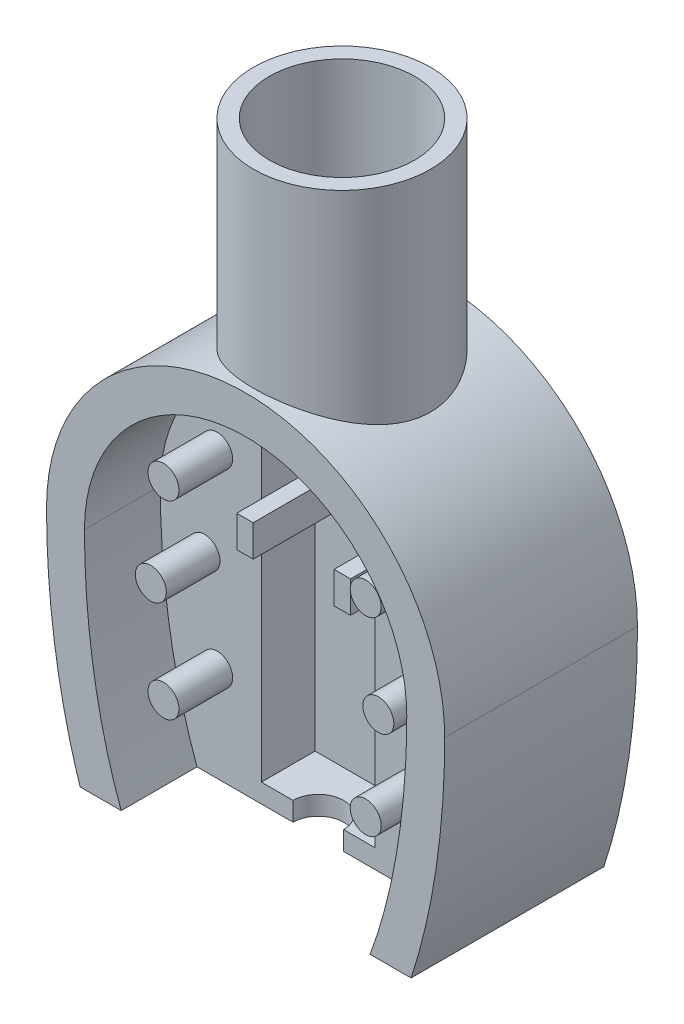
from build123d import *

# Parameters (mm, degrees)
SALIENTE_EXTRUIR2_DEPTH      = 30.5
CROQUIS14_R                  = 25.5
CORTAR_EXTRUIR1_DEPTH        = 12
SALIENTE_EXTRUIR3_DEPTH      = 30
SALIENTE_EXTRUIR3_DEPTH_BACK = 4
CROQUIS15_R                  = 14
CROQUIS16_R                  = 11.5
CORTAR_EXTRUIR2_DEPTH        = 25
SKETCH1_W                    = 18
SKETCH1_H                    = 53
CUT_EXTRUDE1_DEPTH           = 8.5
SKETCH2_R                    = 4
CUT_EXTRUDE2_DEPTH           = 3
SKETCH3_R                    = 2.45
BOSS_EXTRUDE1_DEPTH          = 8.5
SKETCH4_W                    = 2.6
SKETCH4_H                    = 5
BOSS_EXTRUDE2_DEPTH          = 12.4


with BuildPart() as part:
    # Croquis13 → Saliente-Extruir2 (new body)
    with BuildSketch(Plane.XY):
        with BuildLine():
            Line((63.278452832, -47.557716663), (115.634697867, -47.557716663))
            add(Edge.make_bspline(
                [(115.634697867, -47.557716663), (120.956575349, -31.401681318), (120.956575349, -11.961207195)],
                knots=[0.980995561, 0.980995561, 0.980995561, 1.570796327, 1.570796327, 1.570796327], degree=2, weights=[1, 0.9568311, 1]))
            ThreePointArc((120.956575349, -11.961207195), (89.456575349, 19.538792805), (57.956575349, -11.961207195))
            add(Edge.make_bspline(
                [(57.956575349, -11.961207195), (57.956575349, -31.401681318), (63.278452832, -47.557716663)],
                knots=[4.71238898, 4.71238898, 4.71238898, 5.302189747, 5.302189747, 5.302189747], degree=2, weights=[1, 0.9568311, 1]))
        make_face()
    extrude(amount=SALIENTE_EXTRUIR2_DEPTH)

    # Croquis14 → Cortar-Extruir1 (cut)
    with BuildSketch(Plane.XY.offset(30.5)):
        with Locations((89.456575349, -11.961207195)):
            Circle(CROQUIS14_R)
        with BuildLine():
            add(Edge.make_bspline(
                [(109.141957532, -47.557716663), (114.956575349, -32.049805489), (114.956575349, -11.961207195)],
                knots=[4.023536226, 4.023536226, 4.023536226, 4.71238898, 4.71238898, 4.71238898], degree=2, weights=[1, 0.941269295, 1]))
            ThreePointArc((114.956575349, -11.961207195), (89.456575349, -37.461207195), (63.956575349, -11.961207195))
            add(Edge.make_bspline(
                [(63.956575349, -11.961207195), (63.956575349, -32.049805489), (69.771193166, -47.557716663)],
                knots=[1.570796327, 1.570796327, 1.570796327, 2.259649081, 2.259649081, 2.259649081], degree=2, weights=[1, 0.941269295, 1]))
            Line((69.771193166, -47.557716663), (109.141957532, -47.557716663))
        make_face()
    extrude(amount=-CORTAR_EXTRUIR1_DEPTH, mode=Mode.SUBTRACT)

    # Croquis15 → Saliente-Extruir3 (add, two sides: drawn at the far end of the back side and taken through both)
    with BuildSketch(Plane(origin=(89.456575349, 19.538792805, 30.5), x_dir=(1, 0, 0), z_dir=(0, 1, 0)).offset(-SALIENTE_EXTRUIR3_DEPTH_BACK)):
        with Locations(Location((0, 15.25, 0), (0, 0, 270))):
            Circle(CROQUIS15_R)
    extrude(amount=SALIENTE_EXTRUIR3_DEPTH + SALIENTE_EXTRUIR3_DEPTH_BACK)

    # Croquis16 → Cortar-Extruir2 (cut)
    with BuildSketch(Plane(origin=(0, 49.538792805, 0), x_dir=(1, 0, 0), z_dir=(0, 1, 0))):
        with Locations(Location((89.456575349, -15.25, 0), (0, 0, 270))):
            Circle(CROQUIS16_R)
    extrude(amount=-CORTAR_EXTRUIR2_DEPTH, mode=Mode.SUBTRACT)

    # Sketch1 → Cut-Extrude1 (cut)
    with BuildSketch(Plane(origin=(0, -29.057716663, 18.5), x_dir=(-1, 0, 0), z_dir=(0, 0, -1))):
        with Locations((-88.956575349, 11)):
            Rectangle(SKETCH1_W, SKETCH1_H)
    extrude(amount=CUT_EXTRUDE1_DEPTH, mode=Mode.SUBTRACT)

    # Sketch2 → Cut-Extrude2 (cut)
    with BuildSketch(Plane.XZ.offset(44.557716663)):
        with Locations((88.956575349, 18.5)):
            Circle(SKETCH2_R)
    extrude(amount=CUT_EXTRUDE2_DEPTH, mode=Mode.SUBTRACT)

    # Sketch3 → Boss-Extrude1 (add)
    with BuildSketch(Plane.XY.offset(18.5)):
        with Locations((104.956575349, -32.557716663)):
            Circle(SKETCH3_R)
        with Locations((104.956575349, -2.557716663)):
            Circle(SKETCH3_R)
        with Locations((70.956575349, -17.557716663)):
            Circle(SKETCH3_R)
        with Locations((106.956575349, -17.557716663)):
            Circle(SKETCH3_R)
        with Locations((72.956575349, -32.557716663)):
            Circle(SKETCH3_R)
        with Locations((72.956575349, -2.557716663)):
            Circle(SKETCH3_R)
    extrude(amount=BOSS_EXTRUDE1_DEPTH)

    # Sketch4 → Boss-Extrude2 (add)
    with BuildSketch(Plane.XY.offset(10)):
        with Locations((81.256575349, -8.257716663)):
            Rectangle(SKETCH4_W, SKETCH4_H)
        with Locations((96.656575349, -8.257716663)):
            Rectangle(SKETCH4_W, SKETCH4_H)
    extrude(amount=BOSS_EXTRUDE2_DEPTH)


solid = part.part
